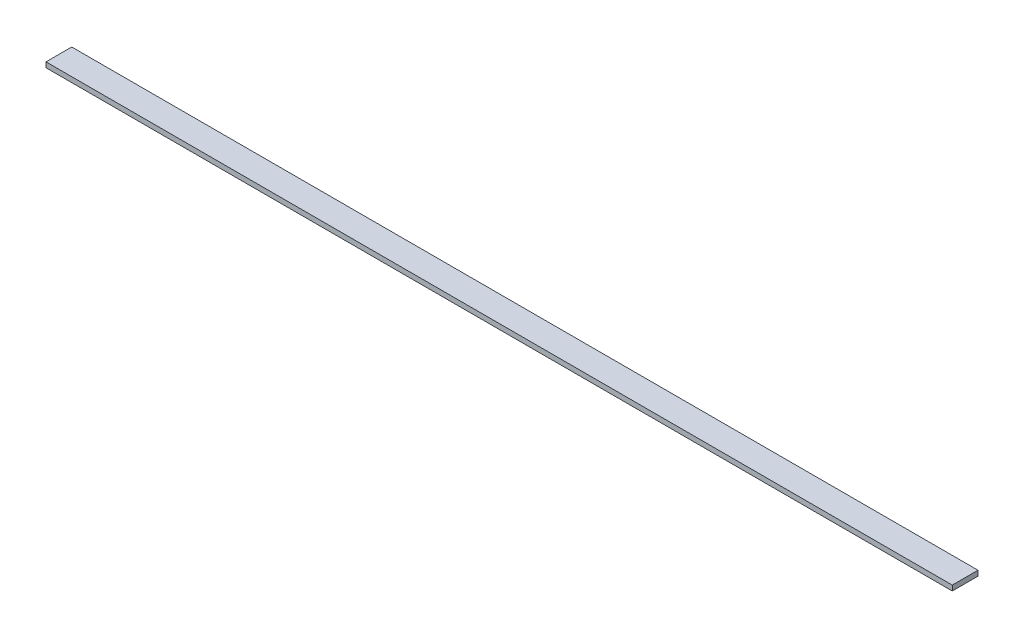
from build123d import *

# Parameters (mm, degrees)
SKETCH_1_W      = 352.21
SKETCH_1_H      = 10
EXTRUDE_1_DEPTH = 2


with BuildPart() as part:
    # 草图1 → 凸台-拉伸1 (new body)
    with BuildSketch(Plane(origin=(0, 0, 0), x_dir=(1, 0, 0), z_dir=(0, 1, 0))):
        with Locations((110.826533186, 18.105991967)):
            Rectangle(SKETCH_1_W, SKETCH_1_H)
    extrude(amount=EXTRUDE_1_DEPTH)


solid = part.part
